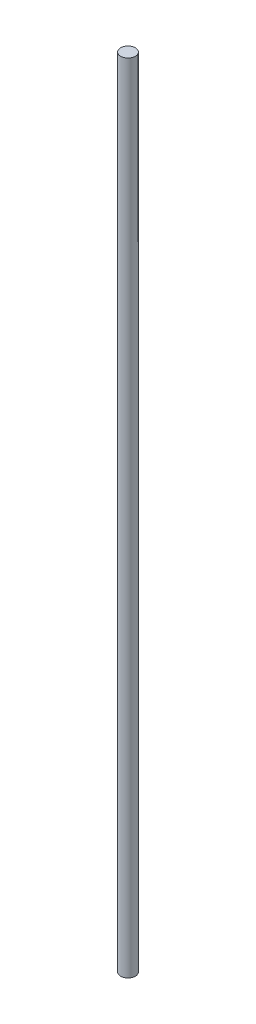
from build123d import *

# Parameters (mm, degrees)
SKETCH1_R           = 3
BOSS_EXTRUDE1_DEPTH = 324.5


with BuildPart() as part:
    # Sketch1 → Boss-Extrude1 (new body)
    with BuildSketch(Plane(origin=(0, 0, 0), x_dir=(1, 0, 0), z_dir=(0, 1, 0))):
        with Locations(Location((0, 0, 0), (0, 0, 90))):
            Circle(SKETCH1_R)
    extrude(amount=BOSS_EXTRUDE1_DEPTH)


solid = part.part
